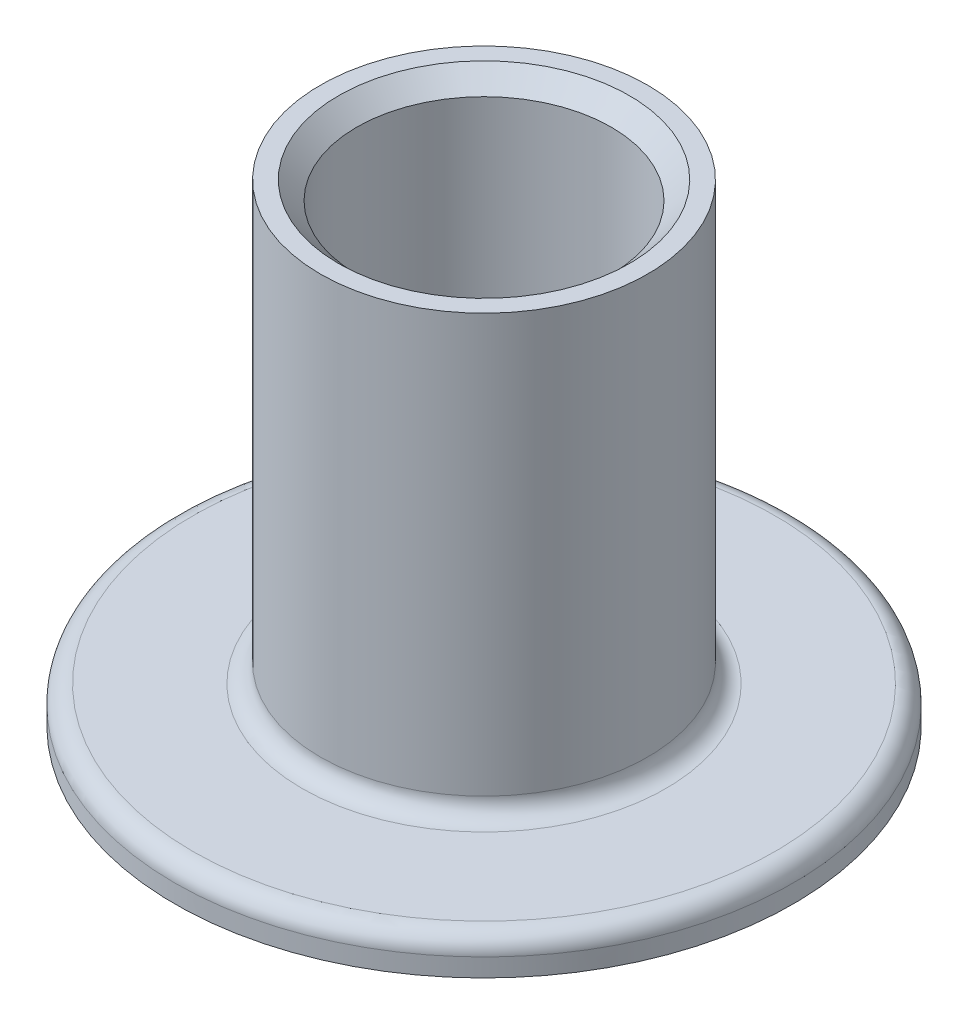
from build123d import *

# Parameters (mm, degrees)
FILLET1_R     = 2.5
CHAMFER2_SIZE = 2.5


with BuildPart() as part:
    # Sketch1 → Revolve1 (revolve)
    with BuildSketch(Plane.XY, mode=Mode.PRIVATE) as revolve1_sk:
        Polygon((0, 0), (42.5, 0), (42.5, 5), (22.5, 5), (22.5, 5.29877748), (22.5, 65), (17.5, 65), (17.5, 22.82917197), (0, 5.32917197), align=None)
    revolve(revolve1_sk.sketch.rotate(Axis((0, 0, 0), (0, 1, 0)), 90), axis=Axis((0, 0, 0), (0, 1, 0)))

    # Fillet1
    fillet1_edges = [part.edges().sort_by_distance(p)[0] for p in [
        (0, 5, 42.5),
        (0, 5, 22.5),
    ]]
    fillet(fillet1_edges, radius=FILLET1_R)

    # Chamfer2
    chamfer2_edges = [part.edges().sort_by_distance(p)[0] for p in [
        (0, 65, 17.5),
    ]]
    chamfer(chamfer2_edges, length=CHAMFER2_SIZE)


solid = part.part
